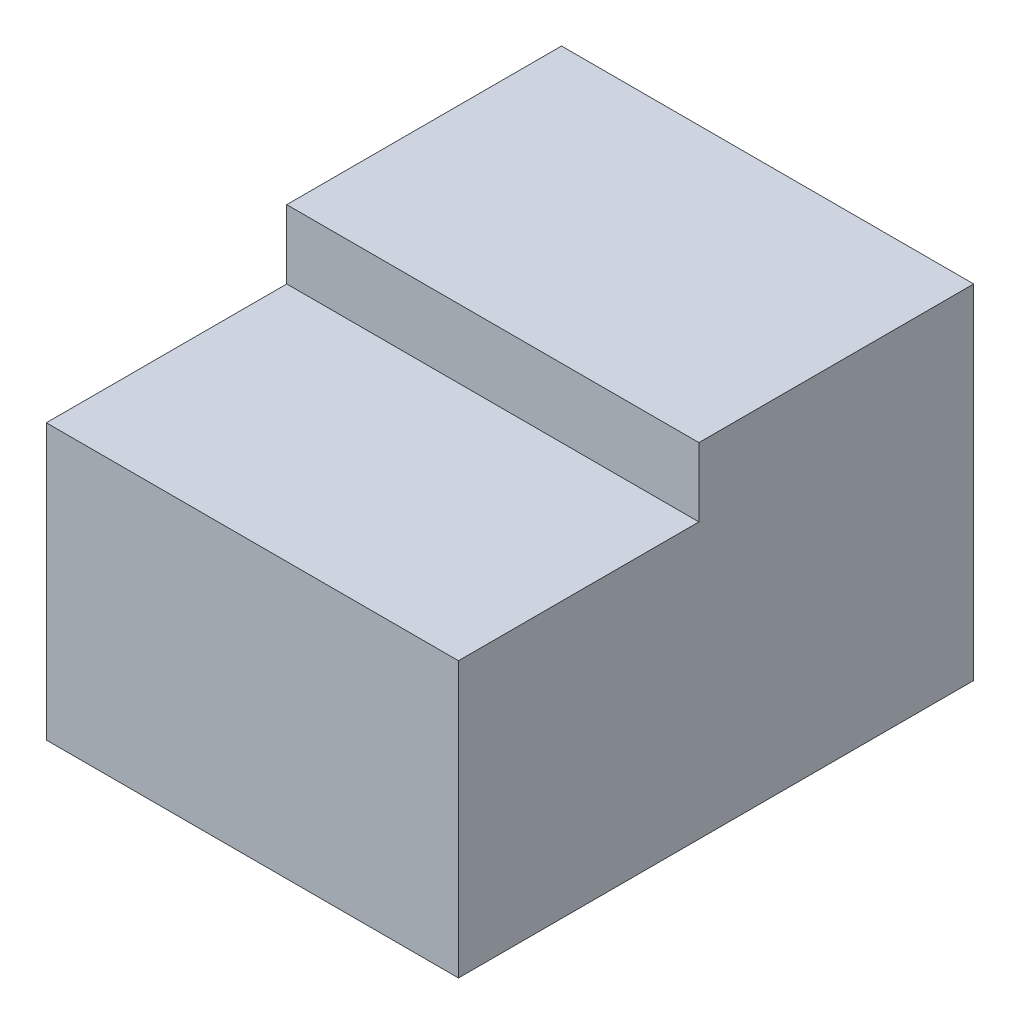
from build123d import *

# Parameters (mm, degrees)
BOSS_EXTRUDE1_DEPTH = 12
CUT_EXTRUDE1_DEPTH  = 5
CUT_EXTRUDE2_DEPTH  = 5


with BuildPart() as part:
    # Sketch2 → Boss-Extrude1 (new body)
    with BuildSketch(Plane(origin=(0, 0, 0), x_dir=(0, 0, -1), z_dir=(1, 0, 0))):
        Polygon((0, 0), (-15, 0), (-15, 8), (-8, 8), (-8, 10), (0, 10), align=None)
    extrude(amount=BOSS_EXTRUDE1_DEPTH)

    # Sketch3 → Cut-Extrude1 (cut)
    with BuildSketch(Plane(origin=(0, 0, 0), x_dir=(-1, 0, 0), z_dir=(0, 0, -1))):
        Polygon((-3.690598923, 9), (-8.309401077, 9), (-10.618802154, 5), (-8.309401077, 1), (-3.690598923, 1), (-1.381197846, 5), align=None)
    extrude(amount=-CUT_EXTRUDE1_DEPTH, mode=Mode.SUBTRACT)

    # Sketch4 → Cut-Extrude2 (cut)
    with BuildSketch(Plane.XZ):
        Polygon((3.690598923, 6), (8.309401077, 6), (10.618802154, 10), (8.309401077, 14), (3.690598923, 14), (1.381197846, 10), align=None)
    extrude(amount=-CUT_EXTRUDE2_DEPTH, mode=Mode.SUBTRACT)


solid = part.part
